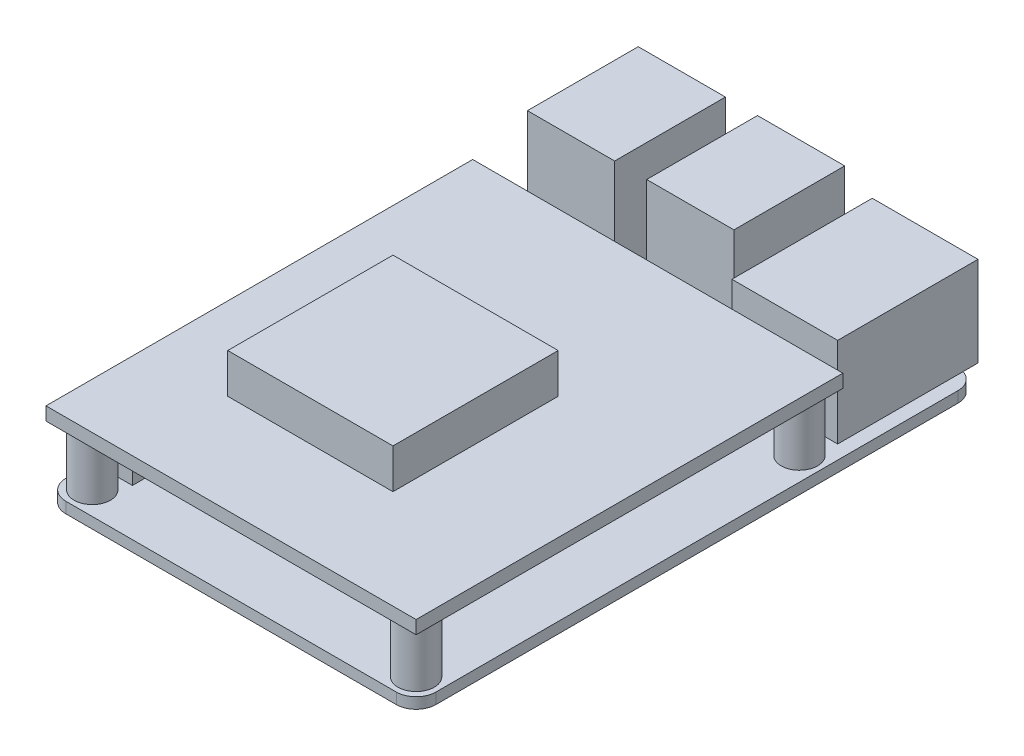
from build123d import *

# Parameters (mm, degrees)
SKETCH1_R           = 1.75
BOSS_EXTRUDE1_DEPTH = 1.651
SKETCH2_W           = 13.1953
SKETCH2_H           = 16.764
BOSS_EXTRUDE2_DEPTH = 15.748
SKETCH4_W           = 16.002
SKETCH4_H           = 21.23186
BOSS_EXTRUDE3_DEPTH = 13.589
SKETCH3_W           = 10.6553
SKETCH3_H           = 5.969
SKETCH3_W_2         = 13.462
SKETCH3_H_2         = 11.049
CUT_EXTRUDE1_DEPTH  = 15.748
SKETCH5_W           = 4.953
SKETCH5_H           = 50.8
BOSS_EXTRUDE4_DEPTH = 2.4892
SKETCH6_W           = 0.5969
SKETCH6_H           = 0.5969
BOSS_EXTRUDE5_DEPTH = 5.8928
SKETCH7_W           = 13.9954
SKETCH7_H           = 13.9954
BOSS_EXTRUDE6_DEPTH = 2.54
SKETCH9_R           = 2.75
SKETCH9_R_2         = 1.75
BOSS_EXTRUDE7_DEPTH = 11
SKETCH10_W          = 25
SKETCH10_H          = 25
BOSS_EXTRUDE8_DEPTH = 6
SKETCH11_W          = 56
SKETCH11_H          = 64.562751879
BOSS_EXTRUDE9_DEPTH = 2


with BuildPart() as part:
    # Sketch1 → Boss-Extrude1 (new body)
    with BuildSketch(Plane(origin=(0, 0, 0), x_dir=(1, 0, 0), z_dir=(0, 1, 0))):
        with BuildLine():
            Line((-25, -42.5), (25, -42.5))
            ThreePointArc((25, -42.5), (27.121320344, -41.621320344), (28, -39.5))
            Line((28, -39.5), (28, 39.5))
            ThreePointArc((28, 39.5), (27.121320344, 41.621320344), (25, 42.5))
            Line((25, 42.5), (-25, 42.5))
            ThreePointArc((-25, 42.5), (-27.121320344, 41.621320344), (-28, 39.5))
            Line((-28, 39.5), (-28, -39.5))
            ThreePointArc((-28, -39.5), (-27.121320344, -41.621320344), (-25, -42.5))
        make_face()
        with Locations(Location((24.5, 19, 0), (0, 0, 90))):
            Circle(SKETCH1_R, mode=Mode.SUBTRACT)
        with Locations(Location((-24.5, 19, 0), (0, 0, 90))):
            Circle(SKETCH1_R, mode=Mode.SUBTRACT)
        with Locations(Location((-24.5, -39, 0), (0, 0, 90))):
            Circle(SKETCH1_R, mode=Mode.SUBTRACT)
        with Locations(Location((24.5, -39, 0), (0, 0, 90))):
            Circle(SKETCH1_R, mode=Mode.SUBTRACT)
    extrude(amount=BOSS_EXTRUDE1_DEPTH)

    # Sketch2 → Boss-Extrude2 (add)
    with BuildSketch(Plane(origin=(0, 1.651, 0), x_dir=(1, 0, 0), z_dir=(0, 1, 0))):
        with Locations((-18.91315, 36.2389)):
            Rectangle(SKETCH2_W, SKETCH2_H)
        with Locations((-0.86645, 36.2389)):
            Rectangle(SKETCH2_W, SKETCH2_H)
    extrude(amount=BOSS_EXTRUDE2_DEPTH)

    # Sketch4 → Boss-Extrude3 (add)
    with BuildSketch(Plane(origin=(0, 1.651, 0), x_dir=(1, 0, 0), z_dir=(0, 1, 0))):
        with Locations((17.8978, 34.00497)):
            Rectangle(SKETCH4_W, SKETCH4_H)
    extrude(amount=BOSS_EXTRUDE3_DEPTH)

    # Sketch3 → Cut-Extrude1 (cut)
    with BuildSketch(Plane(origin=(0, 0, -44.6209), x_dir=(-1, 0, 0), z_dir=(0, 0, -1))):
        with Locations((18.91315, 5.9055)):
            Rectangle(SKETCH3_W, SKETCH3_H)
        with Locations((18.91315, 13.1445)):
            Rectangle(SKETCH3_W, SKETCH3_H)
        with Locations((0.86645, 5.9055)):
            Rectangle(SKETCH3_W, SKETCH3_H)
        with Locations((0.86645, 13.1445)):
            Rectangle(SKETCH3_W, SKETCH3_H)
        with Locations((-17.8978, 8.4455)):
            Rectangle(SKETCH3_W_2, SKETCH3_H_2)
    extrude(amount=-CUT_EXTRUDE1_DEPTH, mode=Mode.SUBTRACT)

    # Sketch5 → Boss-Extrude4 (add)
    with BuildSketch(Plane(origin=(0, 1.651, 0), x_dir=(1, 0, 0), z_dir=(0, 1, 0))):
        with Locations((-24.5, -10)):
            Rectangle(SKETCH5_W, SKETCH5_H)
    extrude(amount=BOSS_EXTRUDE4_DEPTH)

    # Sketch6 → Boss-Extrude5 (add)
    with BuildSketch(Plane(origin=(0, 4.1402, 0), x_dir=(1, 0, 0), z_dir=(0, 1, 0))):
        with Locations((-25.8081, 13.90775)):
            Rectangle(SKETCH6_W, SKETCH6_H)
        with Locations((-23.1919, 13.90775)):
            Rectangle(SKETCH6_W, SKETCH6_H)
        with Locations((-25.8081, 11.36775)):
            Rectangle(SKETCH6_W, SKETCH6_H)
        with Locations((-23.1919, 11.36775)):
            Rectangle(SKETCH6_W, SKETCH6_H)
        with Locations((-25.8081, 8.82775)):
            Rectangle(SKETCH6_W, SKETCH6_H)
        with Locations((-23.1919, 8.82775)):
            Rectangle(SKETCH6_W, SKETCH6_H)
        with Locations((-25.8081, 6.28775)):
            Rectangle(SKETCH6_W, SKETCH6_H)
        with Locations((-23.1919, 6.28775)):
            Rectangle(SKETCH6_W, SKETCH6_H)
        with Locations((-25.8081, 3.74775)):
            Rectangle(SKETCH6_W, SKETCH6_H)
        with Locations((-23.1919, 3.74775)):
            Rectangle(SKETCH6_W, SKETCH6_H)
        with Locations((-25.8081, 1.20775)):
            Rectangle(SKETCH6_W, SKETCH6_H)
        with Locations((-23.1919, 1.20775)):
            Rectangle(SKETCH6_W, SKETCH6_H)
        with Locations((-25.8081, -1.33225)):
            Rectangle(SKETCH6_W, SKETCH6_H)
        with Locations((-23.1919, -1.33225)):
            Rectangle(SKETCH6_W, SKETCH6_H)
        with Locations((-25.8081, -3.87225)):
            Rectangle(SKETCH6_W, SKETCH6_H)
        with Locations((-23.1919, -3.87225)):
            Rectangle(SKETCH6_W, SKETCH6_H)
        with Locations((-25.8081, -6.41225)):
            Rectangle(SKETCH6_W, SKETCH6_H)
        with Locations((-23.1919, -6.41225)):
            Rectangle(SKETCH6_W, SKETCH6_H)
        with Locations((-25.8081, -8.95225)):
            Rectangle(SKETCH6_W, SKETCH6_H)
        with Locations((-23.1919, -8.95225)):
            Rectangle(SKETCH6_W, SKETCH6_H)
        with Locations((-25.8081, -11.49225)):
            Rectangle(SKETCH6_W, SKETCH6_H)
        with Locations((-23.1919, -11.49225)):
            Rectangle(SKETCH6_W, SKETCH6_H)
        with Locations((-25.8081, -14.03225)):
            Rectangle(SKETCH6_W, SKETCH6_H)
        with Locations((-23.1919, -14.03225)):
            Rectangle(SKETCH6_W, SKETCH6_H)
        with Locations((-25.8081, -16.57225)):
            Rectangle(SKETCH6_W, SKETCH6_H)
        with Locations((-23.1919, -16.57225)):
            Rectangle(SKETCH6_W, SKETCH6_H)
        with Locations((-25.8081, -19.11225)):
            Rectangle(SKETCH6_W, SKETCH6_H)
        with Locations((-23.1919, -19.11225)):
            Rectangle(SKETCH6_W, SKETCH6_H)
        with Locations((-25.8081, -21.65225)):
            Rectangle(SKETCH6_W, SKETCH6_H)
        with Locations((-23.1919, -21.65225)):
            Rectangle(SKETCH6_W, SKETCH6_H)
        with Locations((-25.8081, -24.19225)):
            Rectangle(SKETCH6_W, SKETCH6_H)
        with Locations((-23.1919, -24.19225)):
            Rectangle(SKETCH6_W, SKETCH6_H)
        with Locations((-25.8081, -26.73225)):
            Rectangle(SKETCH6_W, SKETCH6_H)
        with Locations((-23.1919, -26.73225)):
            Rectangle(SKETCH6_W, SKETCH6_H)
        with Locations((-25.8081, -29.27225)):
            Rectangle(SKETCH6_W, SKETCH6_H)
        with Locations((-23.1919, -29.27225)):
            Rectangle(SKETCH6_W, SKETCH6_H)
        with Locations((-25.8081, -31.81225)):
            Rectangle(SKETCH6_W, SKETCH6_H)
        with Locations((-23.1919, -31.81225)):
            Rectangle(SKETCH6_W, SKETCH6_H)
        with Locations((-25.8081, -34.35225)):
            Rectangle(SKETCH6_W, SKETCH6_H)
        with Locations((-23.1919, -34.35225)):
            Rectangle(SKETCH6_W, SKETCH6_H)
    extrude(amount=BOSS_EXTRUDE5_DEPTH)

    # Sketch7 → Boss-Extrude6 (add)
    with BuildSketch(Plane(origin=(0, 1.651, 0), x_dir=(1, 0, 0), z_dir=(0, 1, 0))):
        with Locations((-3.5196, -15.9443)):
            Rectangle(SKETCH7_W, SKETCH7_H)
    extrude(amount=BOSS_EXTRUDE6_DEPTH)

    # Sketch9 → Boss-Extrude7 (add)
    # profile 1 of 4: a face of its own
    with BuildSketch(Plane(origin=(0, 1.651, 0), x_dir=(1, 0, 0), z_dir=(0, 1, 0))):
        with Locations(Location((-24.5, -39, 0), (0, 0, 270))):
            Circle(SKETCH9_R)
        with Locations(Location((-24.5, -39, 0), (0, 0, 90))):
            Circle(SKETCH9_R_2, mode=Mode.SUBTRACT)
    # profile 2 of 4: a face of its own
    with BuildSketch(Plane(origin=(0, 1.651, 0), x_dir=(1, 0, 0), z_dir=(0, 1, 0))):
        with Locations(Location((24.5, -39, 0), (0, 0, 270))):
            Circle(SKETCH9_R)
        with Locations(Location((24.5, -39, 0), (0, 0, 90))):
            Circle(SKETCH9_R_2, mode=Mode.SUBTRACT)
    # profile 3 of 4: a face of its own
    with BuildSketch(Plane(origin=(0, 1.651, 0), x_dir=(1, 0, 0), z_dir=(0, 1, 0))):
        with Locations(Location((24.5, 19, 0), (0, 0, 270))):
            Circle(SKETCH9_R)
        with Locations(Location((24.5, 19, 0), (0, 0, 90))):
            Circle(SKETCH9_R_2, mode=Mode.SUBTRACT)
    # profile 4 of 4: a face of its own
    with BuildSketch(Plane(origin=(0, 1.651, 0), x_dir=(1, 0, 0), z_dir=(0, 1, 0))):
        with Locations(Location((-24.5, 19, 0), (0, 0, 270))):
            Circle(SKETCH9_R)
        with Locations(Location((-24.5, 19, 0), (0, 0, 90))):
            Circle(SKETCH9_R_2, mode=Mode.SUBTRACT)
    extrude(amount=BOSS_EXTRUDE7_DEPTH)



with BuildPart() as body_2:
    # Sketch10 → Boss-Extrude8 (new body)
    with BuildSketch(Plane(origin=(0, 12.651, 0), x_dir=(1, 0, 0), z_dir=(0, 1, 0))):
        with Locations((-3, -15)):
            Rectangle(SKETCH10_W, SKETCH10_H)
    extrude(amount=BOSS_EXTRUDE8_DEPTH)


with BuildPart() as part_1:
    add(part.part)

    add(body_2.part)  # Boss-Extrude9 merges body 2
    # Sketch11 → Boss-Extrude9 (add)
    with BuildSketch(Plane(origin=(0, 12.651, 0), x_dir=(1, 0, 0), z_dir=(0, 1, 0))):
        with Locations((0, -10.21862406)):
            Rectangle(SKETCH11_W, SKETCH11_H)
    extrude(amount=-BOSS_EXTRUDE9_DEPTH)


solid = part_1.part
